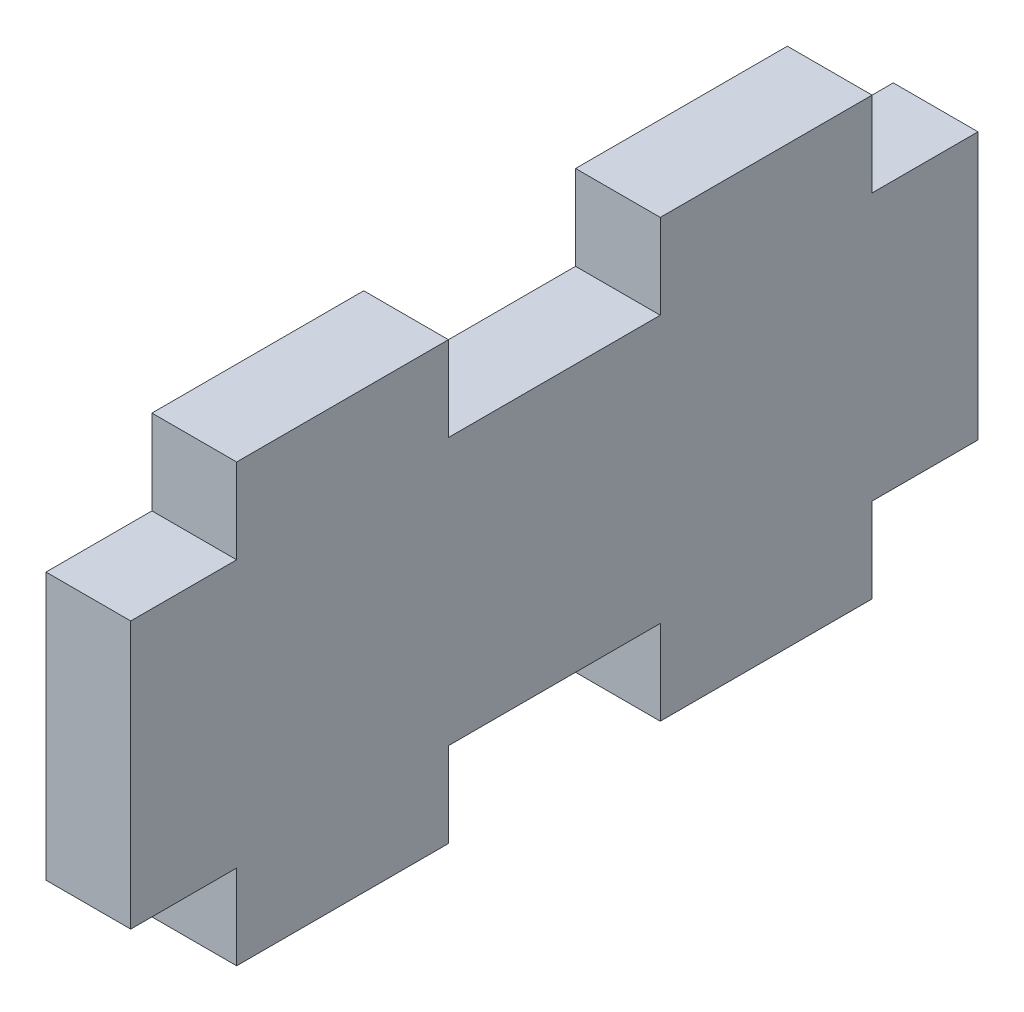
from build123d import *

# Parameters (mm, degrees)
BOSS_EXTRUDE1_DEPTH = 2


with BuildPart() as part:
    # Sketch1 → Boss-Extrude1 (new body)
    with BuildSketch(Plane(origin=(0, 0, 0), x_dir=(0, 0, -1), z_dir=(1, 0, 0))):
        Polygon((-7.5, 3.15), (-7.5, 5.15), (-2.5, 5.15), (-2.5, 3.15), (2.5, 3.15), (2.5, 5.15), (7.5, 5.15), (7.5, 3.15), (10, 3.15), (10, -3.15), (7.5, -3.15), (7.5, -5.15), (2.5, -5.15), (2.5, -3.15), (-2.5, -3.15), (-2.5, -5.15), (-7.5, -5.15), (-7.5, -3.15), (-10, -3.15), (-10, 3.15), align=None)
    extrude(amount=BOSS_EXTRUDE1_DEPTH)


solid = part.part
